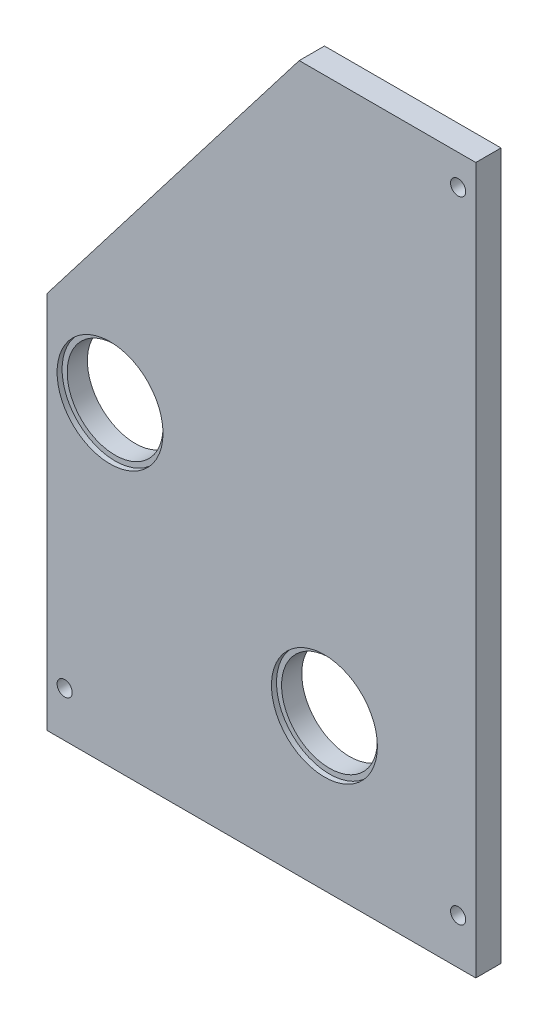
from build123d import *

# Parameters (mm, degrees)
SKETCH1_R           = 1.5
SKETCH1_R_2         = 10.5
BOSS_EXTRUDE1_DEPTH = 5
SKETCH1_3_R         = 10.5
SKETCH1_3_R_2       = 9.5
BOSS_EXTRUDE2_DEPTH = 4
SKETCH3_3_R         = 9.5
CUT_EXTRUDE2_DEPTH  = 5
SKETCH3_R           = 10.5
SKETCH3_R_2         = 9.5
CUT_EXTRUDE3_DEPTH  = 1


with BuildPart() as part:
    # Sketch1 → Boss-Extrude1 (new body)
    # profile 1 of 2: a face of its own
    with BuildSketch(Plane.XY):
        Polygon((-25, 0), (0, 0), (50, 0), (60, 0), (60, 140), (50, 140), (50, 75), (-25, 75), align=None)
        with Locations((-21.5, 9)):
            Circle(SKETCH1_R, mode=Mode.SUBTRACT)
        with Locations((-12.5, 62.5)):
            Circle(SKETCH1_R_2, mode=Mode.SUBTRACT)
        with Locations((56.5, 9)):
            Circle(SKETCH1_R, mode=Mode.SUBTRACT)
        with Locations((56.5, 134)):
            Circle(SKETCH1_R, mode=Mode.SUBTRACT)
    # profile 2 of 2: a face of its own
    with BuildSketch(Plane.XY):
        Polygon((25, 140), (-25, 75), (50, 75), (50, 140), align=None)
    extrude(amount=BOSS_EXTRUDE1_DEPTH)

    # Sketch1<3> → Boss-Extrude2 (add)
    with BuildSketch(Plane.XY):
        with Locations((-12.5, 62.5)):
            Circle(SKETCH1_3_R)
        with Locations((-12.5, 62.5)):
            Circle(SKETCH1_3_R_2, mode=Mode.SUBTRACT)
    extrude(amount=BOSS_EXTRUDE2_DEPTH)

    # Sketch3<3> → Cut-Extrude2 (cut)
    with BuildSketch(Plane.XY.offset(5)):
        with Locations((30, 30)):
            Circle(SKETCH3_3_R)
    extrude(amount=-CUT_EXTRUDE2_DEPTH, mode=Mode.SUBTRACT)

    # Sketch3 → Cut-Extrude3 (cut)
    with BuildSketch(Plane.XY.offset(5)):
        with Locations((30, 30)):
            Circle(SKETCH3_R)
        with Locations((30, 30)):
            Circle(SKETCH3_R_2, mode=Mode.SUBTRACT)
    extrude(amount=-CUT_EXTRUDE3_DEPTH, mode=Mode.SUBTRACT)


solid = part.part
